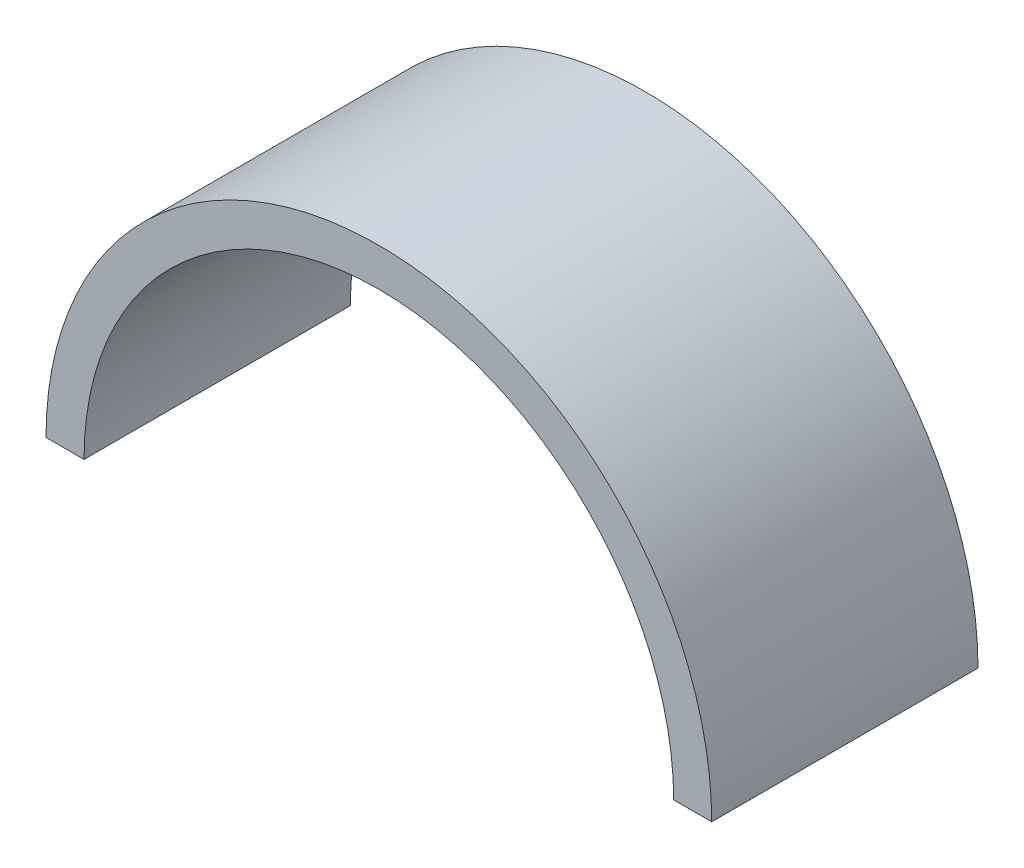
from build123d import *

# Parameters (mm, degrees)
SALIENTE_EXTRUIR1_DEPTH = 14


with BuildPart() as part:
    # Croquis1 → Saliente-Extruir1 (new body)
    with BuildSketch(Plane.XY):
        with BuildLine():
            Line((-17.5, 0), (-15.5, 0))
            ThreePointArc((-15.5, 0), (0, 15.5), (15.5, 0))
            Line((15.5, 0), (17.5, 0))
            ThreePointArc((17.5, 0), (0, 17.5), (-17.5, 0))
        make_face()
    extrude(amount=SALIENTE_EXTRUIR1_DEPTH)


solid = part.part
